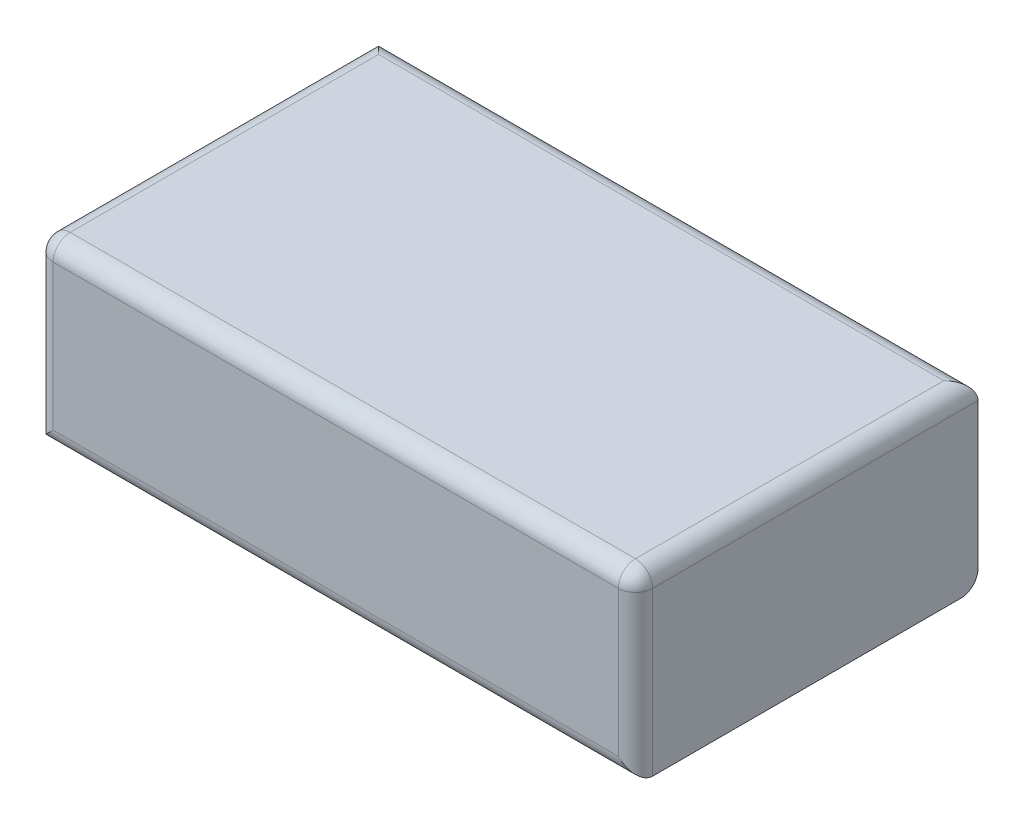
from build123d import *

# Parameters (mm, degrees)
SKETCH_1_W      = 35
SKETCH_1_H      = 20
EXTRUDE_1_DEPTH = 10.5
FILLET_1_R      = 1


with BuildPart() as part:
    # 草图1 → 凸台-拉伸1 (new body)
    with BuildSketch(Plane(origin=(0, 0, 0), x_dir=(1, 0, 0), z_dir=(0, 1, 0))):
        Rectangle(SKETCH_1_W, SKETCH_1_H)
    extrude(amount=EXTRUDE_1_DEPTH)

    # 圆角1
    fillet_1_edges = [part.edges().sort_by_distance(p)[0] for p in [
        (0, 10.5, 10),
        (17.5, 10.5, 0),
        (0, 10.5, -10),
        (0, 0, 10),
        (0, 0, -10),
        (-17.5, 10.5, 0),
        (17.5, 5.25, 10),
        (-17.5, 5.25, 10),
    ]]
    fillet(fillet_1_edges, radius=FILLET_1_R)


solid = part.part
